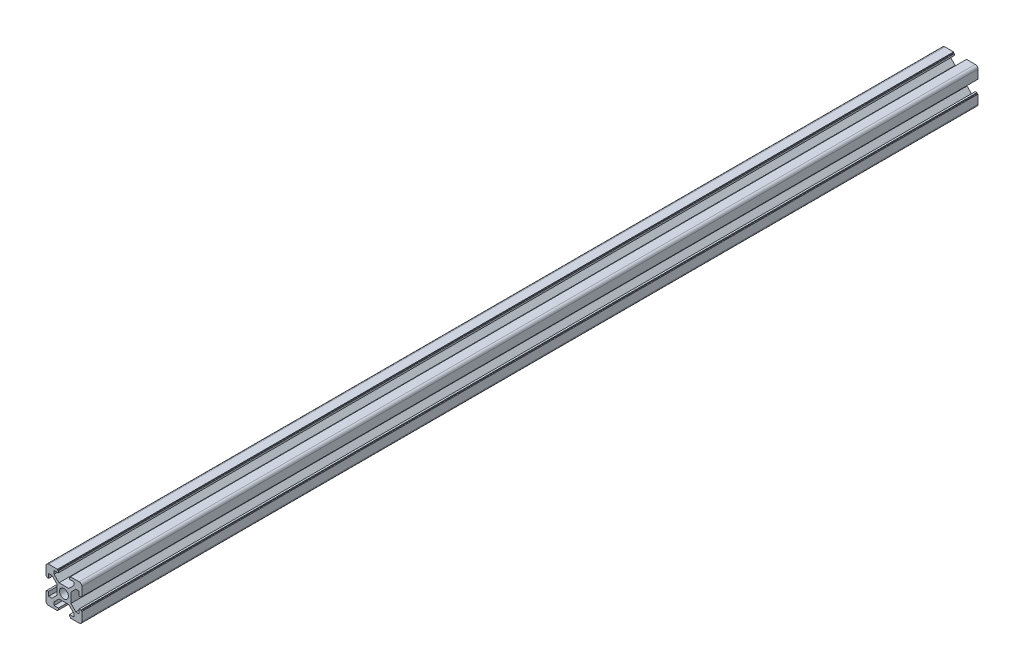
from build123d import *

# Parameters (mm, degrees)
EXTRUDE_1_DEPTH = 500


with BuildPart() as part:
    # 草图1 → 凸台-拉伸1 (new body)
    with BuildSketch(Plane.XY):
        with BuildLine():
            Line((8.5, 10), (3.6, 10))
            Line((3.6, 10), (3.6, 9.5))
            Line((3.6, 9.5), (3.1, 9.5))
            Line((3.1, 9.5), (3.1, 8.5))
            Line((3.1, 8.5), (5.5, 8.5))
            Line((5.5, 8.5), (5.5, 6.65))
            Line((5.5, 6.65), (2.75, 3.9))
            Line((2.75, 3.9), (-2.75, 3.9))
            Line((-2.75, 3.9), (-5.5, 6.65))
            Line((-5.5, 6.65), (-5.5, 8.5))
            Line((-5.5, 8.5), (-3.1, 8.5))
            Line((-3.1, 8.5), (-3.1, 9.5))
            Line((-3.1, 9.5), (-3.6, 9.5))
            Line((-3.6, 9.5), (-3.6, 10))
            Line((-3.6, 10), (-8.5, 10))
            ThreePointArc((-8.5, 10), (-9.560660172, 9.560660172), (-10, 8.5))
            Line((-10, 8.5), (-10, 3.6))
            Line((-10, 3.6), (-9.5, 3.6))
            Line((-9.5, 3.6), (-9.5, 3.1))
            Line((-9.5, 3.1), (-8.5, 3.1))
            Line((-8.5, 3.1), (-8.5, 5.5))
            Line((-8.5, 5.5), (-6.65, 5.5))
            Line((-6.65, 5.5), (-3.9, 2.75))
            Line((-3.9, 2.75), (-3.9, -2.75))
            Line((-3.9, -2.75), (-6.65, -5.5))
            Line((-6.65, -5.5), (-8.5, -5.5))
            Line((-8.5, -5.5), (-8.5, -3.1))
            Line((-8.5, -3.1), (-9.5, -3.1))
            Line((-9.5, -3.1), (-9.5, -3.6))
            Line((-9.5, -3.6), (-10, -3.6))
            Line((-10, -3.6), (-10, -8.5))
            ThreePointArc((-10, -8.5), (-9.560660172, -9.560660172), (-8.5, -10))
            Line((-8.5, -10), (-3.6, -10))
            Line((-3.6, -10), (-3.6, -9.5))
            Line((-3.6, -9.5), (-3.1, -9.5))
            Line((-3.1, -9.5), (-3.1, -8.5))
            Line((-3.1, -8.5), (-5.5, -8.5))
            Line((-5.5, -8.5), (-5.5, -6.65))
            Line((-5.5, -6.65), (-2.75, -3.9))
            Line((-2.75, -3.9), (2.75, -3.9))
            Line((2.75, -3.9), (5.5, -6.65))
            Line((5.5, -6.65), (5.5, -8.5))
            Line((5.5, -8.5), (3.1, -8.5))
            Line((3.1, -8.5), (3.1, -9.5))
            Line((3.1, -9.5), (3.6, -9.5))
            Line((3.6, -9.5), (3.6, -10))
            Line((3.6, -10), (8.5, -10))
            ThreePointArc((8.5, -10), (9.560660172, -9.560660172), (10, -8.5))
            Line((10, -8.5), (10, -3.6))
            Line((10, -3.6), (9.5, -3.6))
            Line((9.5, -3.6), (9.5, -3.1))
            Line((9.5, -3.1), (8.5, -3.1))
            Line((8.5, -3.1), (8.5, -5.5))
            Line((8.5, -5.5), (6.65, -5.5))
            Line((6.65, -5.5), (3.9, -2.75))
            Line((3.9, -2.75), (3.9, 2.75))
            Line((3.9, 2.75), (6.65, 5.5))
            Line((6.65, 5.5), (8.5, 5.5))
            Line((8.5, 5.5), (8.5, 3.1))
            Line((8.5, 3.1), (9.5, 3.1))
            Line((9.5, 3.1), (9.5, 3.6))
            Line((9.5, 3.6), (10, 3.6))
            Line((10, 3.6), (10, 8.5))
            ThreePointArc((10, 8.5), (9.560660172, 9.560660172), (8.5, 10))
        make_face()
        with BuildLine():
            ThreePointArc((-2.5, 0), (0, -2.5), (2.5, 0))
            ThreePointArc((2.5, 0), (0, 2.5), (-2.5, 0))
        make_face(mode=Mode.SUBTRACT)
    extrude(amount=EXTRUDE_1_DEPTH)


solid = part.part
